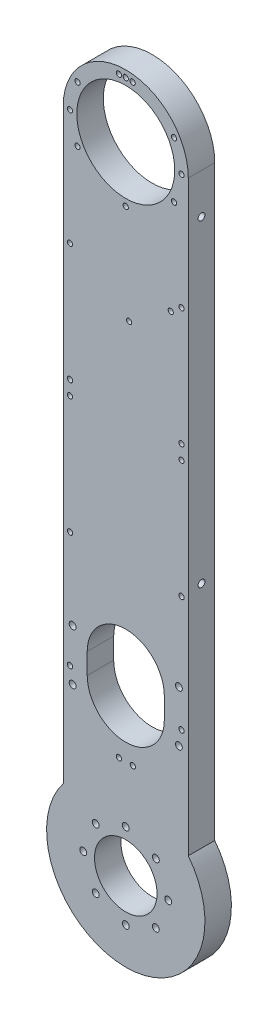
from build123d import *

# Parameters (mm, degrees)
BOSS_EXTRUDE1_DEPTH          = 12.7
CUT_EXTRUDE1_DEPTH           = 338.387447899
HOLE1_D                      = 30
HOLE2_D                      = 47
F_39_0_0995_DIAMETER_HOLE1_D = 2.5273
F_4_CLEARANCE_HOLE1_D        = 3.3
F_2_CLEARANCE_HOLE1_D        = 2.499999999
F_4_CLEARANCE_HOLE2_D        = 3.3
F_4_CLEARANCE_HOLE2_DEPTH    = 10


with BuildPart() as part:
    # Sketch1 → Boss-Extrude1 (new body)
    with BuildSketch(Plane.XY.offset(12.7)):
        with BuildLine():
            Line((-30, 305), (-30, 23.323807579))
            ThreePointArc((-30, 23.323807579), (0, -38), (30, 23.323807579))
            Line((30, 23.323807579), (30, 305))
            ThreePointArc((30, 305), (0, 335), (-30, 305))
        make_face()
    extrude(amount=-BOSS_EXTRUDE1_DEPTH)

    # Sketch2 → Cut-Extrude1 (cut, through all)
    with BuildSketch(Plane(origin=(0, 0, 0), x_dir=(-1, 0, 0), z_dir=(0, 0, -1))):
        with BuildLine():
            Line((18.5, 74.022471071), (18.5, 84.022471071))
            ThreePointArc((18.5, 84.022471071), (0, 102.522471071), (-18.5, 84.022471071))
            Line((-18.5, 84.022471071), (-18.5, 74.022471071))
            ThreePointArc((-18.5, 74.022471071), (0, 55.522471071), (18.5, 74.022471071))
        make_face()
    extrude(amount=-CUT_EXTRUDE1_DEPTH, mode=Mode.SUBTRACT)

    # Hole1 (through all)
    with Locations(Plane.XY.offset(12.7)):
        with Locations((0, 0)):
            Hole(HOLE1_D / 2)

    # Hole2 (through all)
    with Locations(Plane.XY.offset(12.7)):
        with Locations((0, 305)):
            Hole(HOLE2_D / 2)

    # #39 (0.0995) Diameter Hole1 (through all)
    with Locations(Plane.XY.offset(12.7)):
        with Locations((-26.75, 74.022471071), (-26.75, 129.511235535), (-26.75, 186.111235535), (-26.750000001, 192.911235535), (-26.750000001, 249.511235535), (-26.750000001, 305), (-3.300000001, 331.545668196), (3.299999999, 331.545668196), (26.749999999, 305), (26.749999999, 249.511235535), (26.749999999, 192.911235535), (26.75, 186.111235535), (26.75, 129.511235535), (26.75, 74.022471071), (3.4, 47.489425637), (-3.3, 47.476802874), (-23.166179551, 318.375), (-23.166179551, 291.625), (0, 278.25), (23.166179551, 291.625), (23.166179551, 318.375), (0, 331.75)):
            Hole(F_39_0_0995_DIAMETER_HOLE1_D / 2)

    # #4 Clearance Hole1 (through all)
    with Locations(Plane(origin=(0, 0, 0), x_dir=(-1, 0, 0), z_dir=(0, 0, -1))):
        with Locations((-25.5016, 66.772471071), (-25.5016, 91.272471071), (14.424978336, 14.424978336), (20.4, 0), (14.424978336, -14.424978336), (0, -20.4), (-14.424978336, -14.424978336), (-20.4, 0), (-14.424978336, 14.424978336), (0, 20.4), (25.5016, 66.772471071), (25.5016, 91.272471071)):
            Hole(F_4_CLEARANCE_HOLE1_D / 2)

    # #2 Clearance Hole1 (through all)
    with Locations(Plane(origin=(0, 0, 0), x_dir=(-1, 0, 0), z_dir=(0, 0, -1))):
        with Locations((-1.619921459, 231.265288591), (-21.578861519, 245.43367635)):
            Hole(F_2_CLEARANCE_HOLE1_D / 2)

    # #4 Clearance Hole2
    with Locations(Plane(origin=(30, 0, 0), x_dir=(0, 0, -1), z_dir=(1, 0, 0))):
        with Locations((-6.35, 285.723807579), (-6.35, 133.323807579)):
            Hole(F_4_CLEARANCE_HOLE2_D / 2, depth=F_4_CLEARANCE_HOLE2_DEPTH)


solid = part.part
